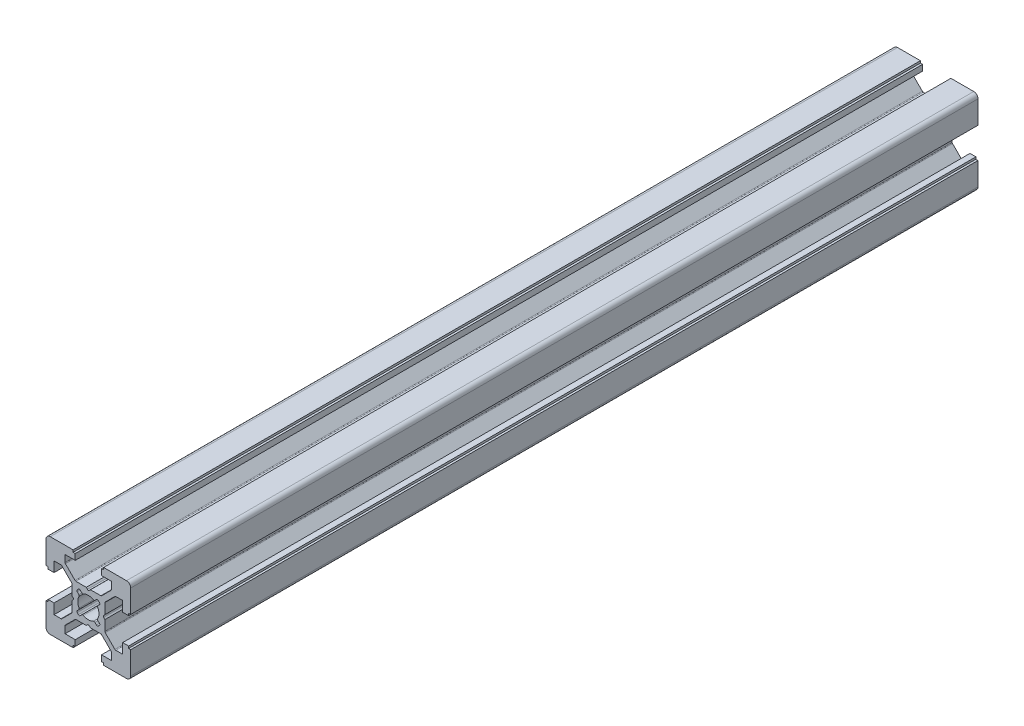
from build123d import *

# Parameters (mm, degrees)
EXTRUDE_1_DEPTH = 200


with BuildPart() as part:
    # Эскиз2 → Бобышка-Вытянуть1 (new body)
    with BuildSketch(Plane.XY):
        with BuildLine():
            Line((3.9, -0.5), (3.9, -2.927207794))
            ThreePointArc((3.9, -2.927207794), (3.92283614, -3.042012824), (3.987867966, -3.139339828))
            Line((3.987867966, -3.139339828), (6.260660172, -5.412132034))
            ThreePointArc((6.260660172, -5.412132034), (6.357987176, -5.47716386), (6.472792206, -5.5))
            Line((6.472792206, -5.5), (8.1, -5.5))
            Line((8.1, -5.5), (8.1, -3.1))
            Line((8.1, -3.1), (9.5, -3.1))
            Line((9.5, -3.1), (9.5, -3.6))
            Line((9.5, -3.6), (10, -3.6))
            Line((10, -3.6), (10, -9))
            ThreePointArc((10, -9), (9.707106781, -9.707106781), (9, -10))
            Line((9, -10), (3.6, -10))
            Line((3.6, -10), (3.6, -9.5))
            Line((3.6, -9.5), (3.1, -9.5))
            Line((3.1, -9.5), (3.1, -8.1))
            Line((3.1, -8.1), (5.5, -8.1))
            Line((5.5, -8.1), (5.5, -6.472792206))
            ThreePointArc((5.5, -6.472792206), (5.47716386, -6.357987176), (5.412132034, -6.260660172))
            Line((5.412132034, -6.260660172), (3.139339828, -3.987867966))
            ThreePointArc((3.139339828, -3.987867966), (3.042012824, -3.92283614), (2.927207794, -3.9))
            Line((2.927207794, -3.9), (0.5, -3.9))
            Line((0.5, -3.9), (0.212132034, -3.612132034))
            ThreePointArc((0.212132034, -3.612132034), (0, -3.524264069), (-0.212132034, -3.612132034))
            Line((-0.212132034, -3.612132034), (-0.5, -3.9))
            Line((-0.5, -3.9), (-2.927207794, -3.9))
            ThreePointArc((-2.927207794, -3.9), (-3.042012824, -3.92283614), (-3.139339828, -3.987867966))
            Line((-3.139339828, -3.987867966), (-5.412132034, -6.260660172))
            ThreePointArc((-5.412132034, -6.260660172), (-5.47716386, -6.357987176), (-5.5, -6.472792206))
            Line((-5.5, -6.472792206), (-5.5, -8.1))
            Line((-5.5, -8.1), (-3.1, -8.1))
            Line((-3.1, -8.1), (-3.1, -9.5))
            Line((-3.1, -9.5), (-3.6, -9.5))
            Line((-3.6, -9.5), (-3.6, -10))
            Line((-3.6, -10), (-9, -10))
            ThreePointArc((-9, -10), (-9.707106781, -9.707106781), (-10, -9))
            Line((-10, -9), (-10, -3.6))
            Line((-10, -3.6), (-9.5, -3.6))
            Line((-9.5, -3.6), (-9.5, -3.1))
            Line((-9.5, -3.1), (-8.1, -3.1))
            Line((-8.1, -3.1), (-8.1, -5.5))
            Line((-8.1, -5.5), (-6.472792206, -5.5))
            ThreePointArc((-6.472792206, -5.5), (-6.357987176, -5.47716386), (-6.260660172, -5.412132034))
            Line((-6.260660172, -5.412132034), (-3.987867966, -3.139339828))
            ThreePointArc((-3.987867966, -3.139339828), (-3.92283614, -3.042012824), (-3.9, -2.927207794))
            Line((-3.9, -2.927207794), (-3.9, -0.5))
            Line((-3.9, -0.5), (-3.612132034, -0.212132034))
            ThreePointArc((-3.612132034, -0.212132034), (-3.524264069, 0), (-3.612132034, 0.212132034))
            Line((-3.612132034, 0.212132034), (-3.9, 0.5))
            Line((-3.9, 0.5), (-3.9, 2.927207794))
            ThreePointArc((-3.9, 2.927207794), (-3.92283614, 3.042012824), (-3.987867966, 3.139339828))
            Line((-3.987867966, 3.139339828), (-6.260660172, 5.412132034))
            ThreePointArc((-6.260660172, 5.412132034), (-6.357987176, 5.47716386), (-6.472792206, 5.5))
            Line((-6.472792206, 5.5), (-8.1, 5.5))
            Line((-8.1, 5.5), (-8.1, 3.1))
            Line((-8.1, 3.1), (-9.5, 3.1))
            Line((-9.5, 3.1), (-9.5, 3.6))
            Line((-9.5, 3.6), (-10, 3.6))
            Line((-10, 3.6), (-10, 9))
            ThreePointArc((-10, 9), (-9.707106781, 9.707106781), (-9, 10))
            Line((-9, 10), (-3.6, 10))
            Line((-3.6, 10), (-3.6, 9.5))
            Line((-3.6, 9.5), (-3.1, 9.5))
            Line((-3.1, 9.5), (-3.1, 8.1))
            Line((-3.1, 8.1), (-5.5, 8.1))
            Line((-5.5, 8.1), (-5.5, 6.472792206))
            ThreePointArc((-5.5, 6.472792206), (-5.47716386, 6.357987176), (-5.412132034, 6.260660172))
            Line((-5.412132034, 6.260660172), (-3.139339828, 3.987867966))
            ThreePointArc((-3.139339828, 3.987867966), (-3.042012824, 3.92283614), (-2.927207794, 3.9))
            Line((-2.927207794, 3.9), (-0.5, 3.9))
            Line((-0.5, 3.9), (-0.212132034, 3.612132034))
            ThreePointArc((-0.212132034, 3.612132034), (0, 3.524264069), (0.212132034, 3.612132034))
            Line((0.212132034, 3.612132034), (0.5, 3.9))
            Line((0.5, 3.9), (2.927207794, 3.9))
            ThreePointArc((2.927207794, 3.9), (3.042012824, 3.92283614), (3.139339828, 3.987867966))
            Line((3.139339828, 3.987867966), (5.412132034, 6.260660172))
            ThreePointArc((5.412132034, 6.260660172), (5.47716386, 6.357987176), (5.5, 6.472792206))
            Line((5.5, 6.472792206), (5.5, 8.1))
            Line((5.5, 8.1), (3.1, 8.1))
            Line((3.1, 8.1), (3.1, 9.5))
            Line((3.1, 9.5), (3.6, 9.5))
            Line((3.6, 9.5), (3.6, 10))
            Line((3.6, 10), (9, 10))
            ThreePointArc((9, 10), (9.707106781, 9.707106781), (10, 9))
            Line((10, 9), (10, 3.6))
            Line((10, 3.6), (9.5, 3.6))
            Line((9.5, 3.6), (9.5, 3.1))
            Line((9.5, 3.1), (8.1, 3.1))
            Line((8.1, 3.1), (8.1, 5.5))
            Line((8.1, 5.5), (6.472792206, 5.5))
            ThreePointArc((6.472792206, 5.5), (6.357987176, 5.47716386), (6.260660172, 5.412132034))
            Line((6.260660172, 5.412132034), (3.987867966, 3.139339828))
            ThreePointArc((3.987867966, 3.139339828), (3.92283614, 3.042012824), (3.9, 2.927207794))
            Line((3.9, 2.927207794), (3.9, 0.5))
            Line((3.9, 0.5), (3.612132034, 0.212132034))
            ThreePointArc((3.612132034, 0.212132034), (3.524264069, 0), (3.612132034, -0.212132034))
            Line((3.612132034, -0.212132034), (3.9, -0.5))
        make_face()
        with BuildLine():
            Line((-1.909188309, 2.61629509), (-1.543813206, 2.250919987))
            ThreePointArc((-1.543813206, 2.250919987), (-1.374992046, 2.16619487), (-1.189001046, 2.19915359))
            ThreePointArc((-1.189001046, 2.19915359), (0, 2.5), (1.189001046, 2.19915359))
            ThreePointArc((1.189001046, 2.19915359), (1.374992046, 2.16619487), (1.543813206, 2.250919987))
            Line((1.543813206, 2.250919987), (1.909188309, 2.61629509))
            ThreePointArc((1.909188309, 2.61629509), (2.121320344, 2.704163056), (2.333452378, 2.61629509))
            Line((2.333452378, 2.61629509), (2.61629509, 2.333452378))
            ThreePointArc((2.61629509, 2.333452378), (2.704163056, 2.121320344), (2.61629509, 1.909188309))
            Line((2.61629509, 1.909188309), (2.250919987, 1.543813206))
            ThreePointArc((2.250919987, 1.543813206), (2.16619487, 1.374992046), (2.19915359, 1.189001046))
            ThreePointArc((2.19915359, 1.189001046), (2.5, 0), (2.19915359, -1.189001046))
            ThreePointArc((2.19915359, -1.189001046), (2.16619487, -1.374992046), (2.250919987, -1.543813206))
            Line((2.250919987, -1.543813206), (2.61629509, -1.909188309))
            ThreePointArc((2.61629509, -1.909188309), (2.704163056, -2.121320344), (2.61629509, -2.333452378))
            Line((2.61629509, -2.333452378), (2.333452378, -2.61629509))
            ThreePointArc((2.333452378, -2.61629509), (2.121320344, -2.704163056), (1.909188309, -2.61629509))
            Line((1.909188309, -2.61629509), (1.543813206, -2.250919987))
            ThreePointArc((1.543813206, -2.250919987), (1.374992046, -2.16619487), (1.189001046, -2.19915359))
            ThreePointArc((1.189001046, -2.19915359), (0, -2.5), (-1.189001046, -2.19915359))
            ThreePointArc((-1.189001046, -2.19915359), (-1.374992046, -2.16619487), (-1.543813206, -2.250919987))
            Line((-1.543813206, -2.250919987), (-1.909188309, -2.61629509))
            ThreePointArc((-1.909188309, -2.61629509), (-2.121320344, -2.704163056), (-2.333452378, -2.61629509))
            Line((-2.333452378, -2.61629509), (-2.61629509, -2.333452378))
            ThreePointArc((-2.61629509, -2.333452378), (-2.704163056, -2.121320344), (-2.61629509, -1.909188309))
            Line((-2.61629509, -1.909188309), (-2.250919987, -1.543813206))
            ThreePointArc((-2.250919987, -1.543813206), (-2.16619487, -1.374992046), (-2.19915359, -1.189001046))
            ThreePointArc((-2.19915359, -1.189001046), (-2.5, 0), (-2.19915359, 1.189001046))
            ThreePointArc((-2.19915359, 1.189001046), (-2.16619487, 1.374992046), (-2.250919987, 1.543813206))
            Line((-2.250919987, 1.543813206), (-2.61629509, 1.909188309))
            ThreePointArc((-2.61629509, 1.909188309), (-2.704163056, 2.121320344), (-2.61629509, 2.333452378))
            Line((-2.61629509, 2.333452378), (-2.333452378, 2.61629509))
            ThreePointArc((-2.333452378, 2.61629509), (-2.121320344, 2.704163056), (-1.909188309, 2.61629509))
        make_face(mode=Mode.SUBTRACT)
    extrude(amount=EXTRUDE_1_DEPTH)


solid = part.part
